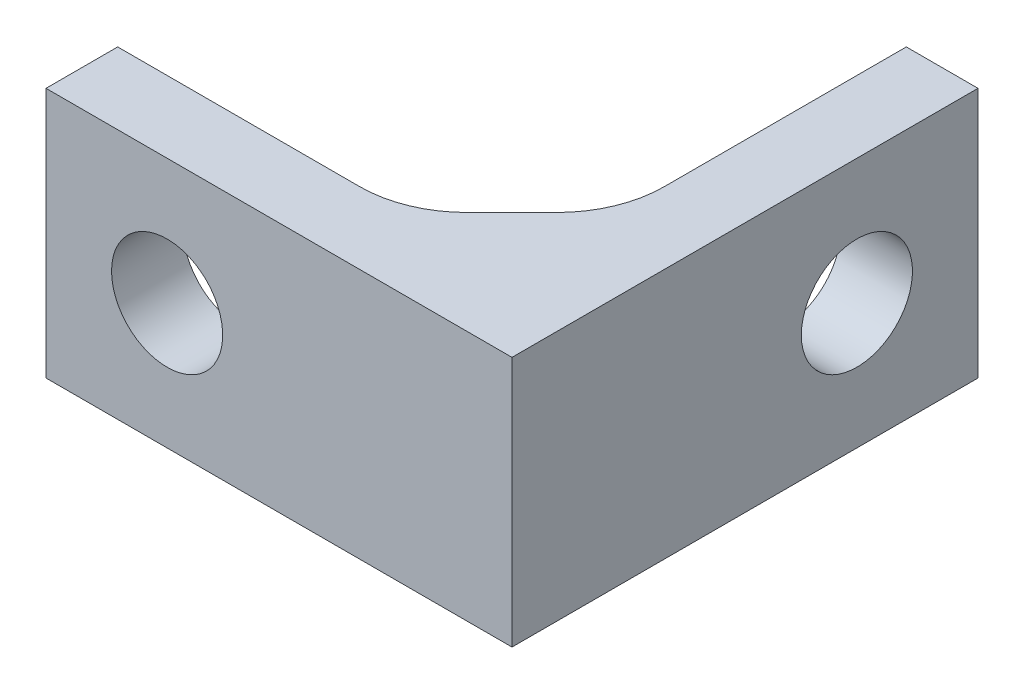
from build123d import *

# Parameters (mm, degrees)
BOSS_EXTRUDE1_DEPTH = 7
CUT_EXTRUDE1_REACH  = 20.412
SKETCH3_R           = 1.55
CUT_EXTRUDE2_REACH  = 20.412
SKETCH4_R           = 1.55


with BuildPart() as part:
    # Sketch1 → Boss-Extrude1 (new body)
    with BuildSketch(Plane(origin=(0, 0, 0), x_dir=(1, 0, 0), z_dir=(0, 1, 0))):
        with BuildLine():
            Line((0, 0), (-13, 0))
            Line((-13, 0), (-13, 2))
            Line((-13, 2), (-6.242640687, 2))
            ThreePointArc((-6.242640687, 2), (-5.09459039, 2.228361402), (-4.121320344, 2.878679656))
            Line((-4.121320344, 2.878679656), (-2.878679656, 4.121320344))
            ThreePointArc((-2.878679656, 4.121320344), (-2.228361402, 5.09459039), (-2, 6.242640687))
            Line((-2, 6.242640687), (-2, 13))
            Line((-2, 13), (0, 13))
            Line((0, 13), (0, 0))
        make_face()
    extrude(amount=BOSS_EXTRUDE1_DEPTH)

    # Sketch3 → Cut-Extrude1 (cut, up to next)
    with BuildSketch(Plane(origin=(0, 0, -2), x_dir=(-1, 0, 0), z_dir=(0, 0, -1)), mode=Mode.PRIVATE) as cut_extrude1_sk1:
        with Locations((9.621320344, 3.5)):
            Circle(SKETCH3_R)
    cut_extrude1_tool1 = extrude(cut_extrude1_sk1.sketch, amount=-CUT_EXTRUDE1_REACH, mode=Mode.PRIVATE) & part.part
    add(cut_extrude1_tool1.solids().sort_by_distance((-9.62132, 3.5, -2))[0], mode=Mode.SUBTRACT)

    # Sketch4 → Cut-Extrude2 (cut, up to next)
    with BuildSketch(Plane.ZY.offset(2), mode=Mode.PRIVATE) as cut_extrude2_sk1:
        with Locations((-9.621320344, 3.5)):
            Circle(SKETCH4_R)
    cut_extrude2_tool1 = extrude(cut_extrude2_sk1.sketch, amount=-CUT_EXTRUDE2_REACH, mode=Mode.PRIVATE) & part.part
    add(cut_extrude2_tool1.solids().sort_by_distance((-2, 3.5, -9.62132))[0], mode=Mode.SUBTRACT)


solid = part.part
